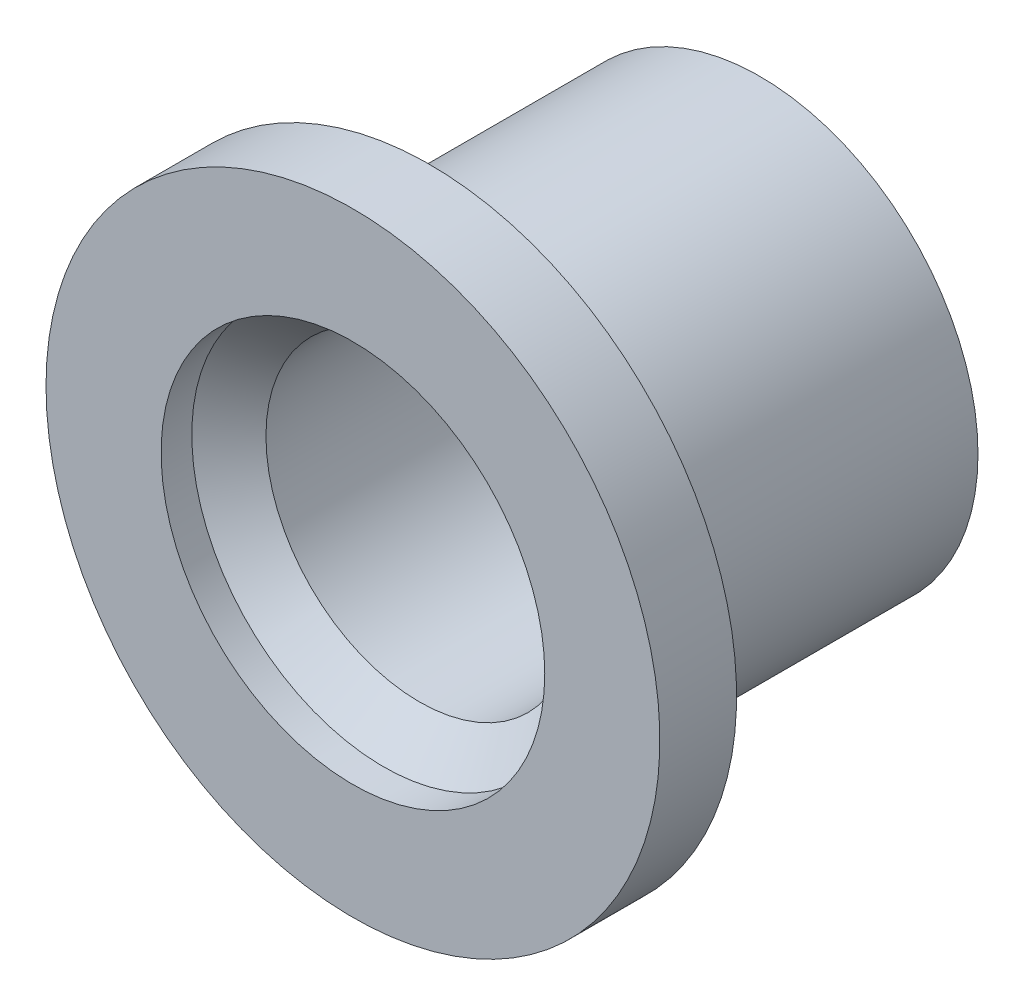
from build123d import *

# Parameters (mm, degrees)
SKETCH1_R           = 5.08
SKETCH1_R_2         = 2.54
BOSS_EXTRUDE1_DEPTH = 0.762
CHAMFER2_SIZE       = 0.635
CHAMFER2_SIZE2      = 0.59214708
SKETCH3_R           = 5.08
SKETCH3_R_2         = 3.175
BOSS_EXTRUDE3_DEPTH = 0.508
BOSS_EXTRUDE4_START = 5.46608
SKETCH4_R           = 3.609397664
SKETCH4_R_2         = 2.54
BOSS_EXTRUDE4_DEPTH = 5.46608


with BuildPart() as part:
    # Sketch1 → Boss-Extrude1 (new body)
    with BuildSketch(Plane.XY):
        with Locations(Location((0, 0, 0), (0, 0, 180))):
            Circle(SKETCH1_R)
        with Locations(Location((0, 0, 0), (0, 0, 180))):
            Circle(SKETCH1_R_2, mode=Mode.SUBTRACT)
    extrude(amount=BOSS_EXTRUDE1_DEPTH)

    # Chamfer2
    chamfer2_edges = [part.edges().sort_by_distance(p)[0] for p in [
        (2.54, 0, 0.762),
    ]]
    chamfer2_side = [part.faces().sort_by_distance(p)[0] for p in [
        (4.936315902, 0, 0.762),
    ]]
    chamfer(chamfer2_edges, length=CHAMFER2_SIZE, length2=CHAMFER2_SIZE2, reference=chamfer2_side[0])

    # Sketch3 → Boss-Extrude3 (add)
    with BuildSketch(Plane.XY.offset(0.762)):
        with Locations(Location((0, 0, 0), (0, 0, 180))):
            Circle(SKETCH3_R)
        Circle(SKETCH3_R_2, mode=Mode.SUBTRACT)
    extrude(amount=BOSS_EXTRUDE3_DEPTH)

    # Sketch4 → Boss-Extrude4 (add)
    with BuildSketch(Plane(origin=(0, 0, 0), x_dir=(-1, 0, 0), z_dir=(0, 0, -1)).offset(BOSS_EXTRUDE4_START)):
        with Locations(Location((0, 0, 0), (0, 0, 180))):
            Circle(SKETCH4_R)
        Circle(SKETCH4_R_2, mode=Mode.SUBTRACT)
    extrude(amount=-BOSS_EXTRUDE4_DEPTH)


solid = part.part
